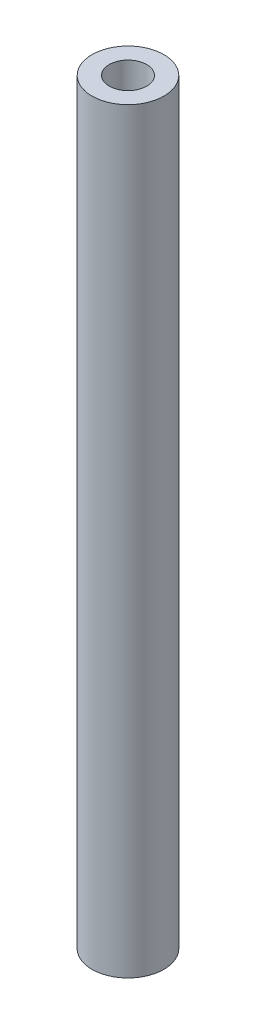
from build123d import *

# Parameters (mm, degrees)
SKETCH1_R           = 11.5
SKETCH1_R_2         = 6
BOSS_EXTRUDE1_DEPTH = 242


with BuildPart() as part:
    # Sketch1 → Boss-Extrude1 (new body)
    with BuildSketch(Plane(origin=(0, 0, 0), x_dir=(1, 0, 0), z_dir=(0, 1, 0))):
        with Locations(Location((0, 0, 0), (0, 0, 270))):
            Circle(SKETCH1_R)
        with Locations(Location((0, 0, 0), (0, 0, 270))):
            Circle(SKETCH1_R_2, mode=Mode.SUBTRACT)
    extrude(amount=BOSS_EXTRUDE1_DEPTH)


solid = part.part
